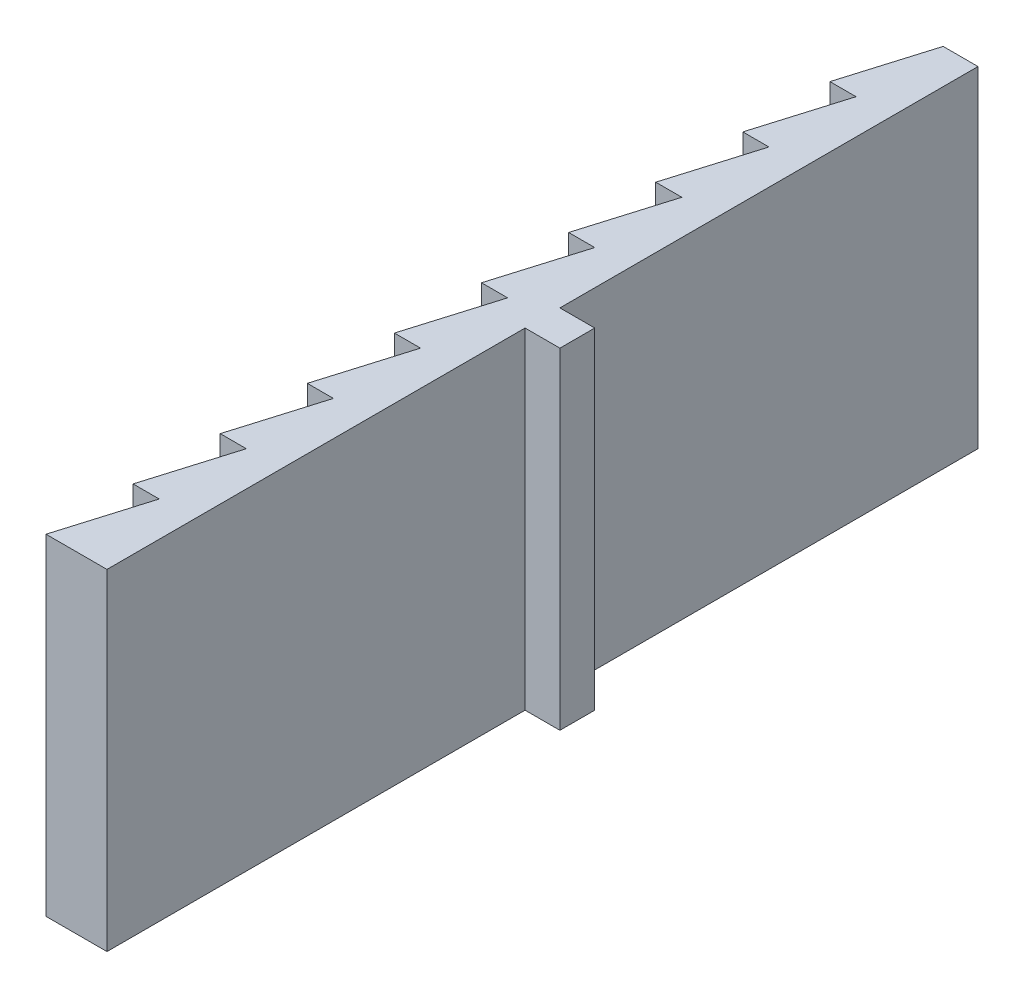
from build123d import *

# Parameters (mm, degrees)
SKETCH1_W           = 1
SKETCH1_H           = 25
BOSS_EXTRUDE1_DEPTH = 9.5
SKETCH2_W           = 1
SKETCH2_H           = 1
BOSS_EXTRUDE2_DEPTH = 9.5


with BuildPart() as part:
    # Sketch1 → Boss-Extrude1 (new body)
    with BuildSketch(Plane(origin=(0, 0, 0), x_dir=(1, 0, 0), z_dir=(0, 1, 0))):
        with Locations((-0.5, 12.5)):
            Rectangle(SKETCH1_W, SKETCH1_H)
        Polygon((-1, 22.5), (-1, 25), (-1.75, 22.5), align=None)
        Polygon((-1, 20), (-1, 22.5), (-1.75, 20), align=None)
        Polygon((-1, 17.5), (-1, 20), (-1.75, 17.5), align=None)
        Polygon((-1, 15), (-1, 17.5), (-1.75, 15), align=None)
        Polygon((-1, 12.5), (-1, 15), (-1.75, 12.5), align=None)
        Polygon((-1.75, 10), (-1, 10), (-1, 12.5), align=None)
        Polygon((-1.75, 7.5), (-1, 7.5), (-1, 10), align=None)
        Polygon((-1.75, 5), (-1, 5), (-1, 7.5), align=None)
        Polygon((-1.75, 0), (-1, 0), (-1, 2.5), align=None)
        Polygon((-1.75, 2.5), (-1, 2.5), (-1, 5), align=None)
    extrude(amount=BOSS_EXTRUDE1_DEPTH)

    # Sketch2 → Boss-Extrude2 (add)
    with BuildSketch(Plane(origin=(0, 9.5, 0), x_dir=(1, 0, 0), z_dir=(0, 1, 0))):
        with Locations((0.5, 12.5)):
            Rectangle(SKETCH2_W, SKETCH2_H)
    extrude(amount=-BOSS_EXTRUDE2_DEPTH)


solid = part.part
